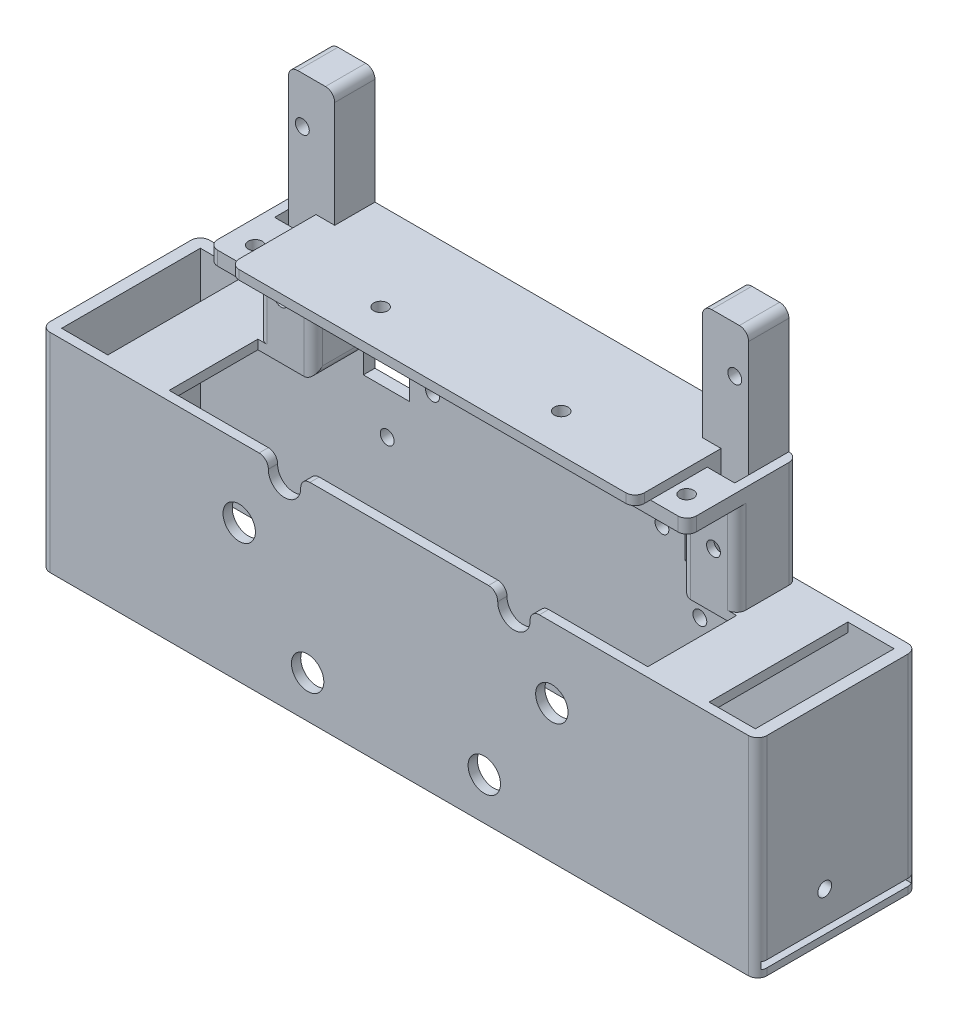
from build123d import *

# Parameters (mm, degrees)
SKETCH_1_W           = 12
SKETCH_1_H           = 3
EXTRUDE_1_DEPTH      = 19
EXTRUDE_START        = 5.8
EXTRUDE_2_DEPTH      = 13.2
SKETCH_1_14_W        = 4.05
SKETCH_1_14_H        = 2
EXTRUDE_3_DEPTH      = 22.3
SKETCH_1_15_W        = 39.75
SKETCH_1_15_H        = 2
EXTRUDE_4_DEPTH      = 16.5
SKETCH_1_16_W        = 12
SKETCH_1_16_H        = 65
EXTRUDE_5_DEPTH      = 3.7
SKETCH_1_20_W        = 39.75
SKETCH_1_20_H        = 26.5
SKETCH_1_20_H_2      = 18.5
SKETCH_1_20_W_2      = 15
SKETCH_1_20_H_3      = 16.5
SKETCH_1_20_W_3      = 24.75
EXTRUDE_6_DEPTH      = 2.5
EXTRUDE_START_2      = 3.7
SKETCH_1_23_W        = 10
SKETCH_1_23_H        = 26.5
SKETCH_1_23_H_2      = 18.5
SKETCH_1_23_H_3      = 3.5
SKETCH_1_23_W_2      = 2
SKETCH_1_23_H_4      = 16.5
EXTRUDE_8_DEPTH      = 4.6
EXTRUDE_START_3      = 27.5
SKETCH_1_25_W        = 39.75
SKETCH_1_25_H        = 26.5
SKETCH_1_25_H_2      = 18.5
SKETCH_1_25_W_2      = 10
EXTRUDE_9_DEPTH      = 2
SKETCH_3_W           = 25.25
SKETCH_3_H           = 45
EXTRUDE_11_DEPTH     = 2
SKETCH_3_4_W         = 2.5
SKETCH_3_4_H         = 45
EXTRUDE_12_DEPTH     = 29.5
EXTRUDE_START_4      = -2.5
SKETCH_5_W           = 8.3
SKETCH_5_H           = 45
EXTRUDE_13_DEPTH     = 23.25
CUT_EXTRUDE_1_REACH  = 151.919
SKETCH_6_W           = 5.95
SKETCH_6_H           = 3
SKETCH_7_W           = 13.25
SKETCH_7_H           = 19.2
EXTRUDE_14_DEPTH     = 2
SKETCH_1_29_W        = 39.75
SKETCH_1_29_H        = 25
SKETCH_1_29_H_2      = 18.5
SKETCH_1_29_H_3      = 26.5
SKETCH_1_29_W_2      = 24.75
SKETCH_1_29_H_4      = 16.5
SKETCH_1_29_W_3      = 15
SKETCH_1_29_H_5      = 2
EXTRUDE_15_DEPTH     = 5.8
CUT_EXTRUDE_START    = 19.2
CUT_EXTRUDE_10_DEPTH = 5.8
SKETCH_9_R           = 1.5
CUT_EXTRUDE_12_DEPTH = 148.650982049
EXTRUDE_START_5      = 5
SKETCH_21_R          = 1.5
EXTRUDE_16_DEPTH     = 5
CUT_EXTRUDE_START_2  = 25
CUT_EXTRUDE_14_DEPTH = 5
CUT_EXTRUDE_START_3  = -10.8
SKETCH_24_R          = 1.5
CUT_EXTRUDE_16_DEPTH = 10.8
CUT_EXTRUDE_15_REACH = 107.364
SKETCH_23_R          = 1.5
FILLET_1_R           = 2
CUT_EXTRUDE_17_REACH = 150.731
SKETCH_25_W          = 10
SKETCH_25_H          = 25.1
SKETCH_25_W_2        = 79.5
SKETCH_25_H_2        = 25
SKETCH_25_4_R        = 1.5
CUT_EXTRUDE_18_DEPTH = 149.730671013
CUT_EXTRUDE_19_REACH = 150.28
SKETCH_28_R          = 1.5
SKETCH_28_R_2        = 3.5
FILLET_2_R           = 2
SKETCH_25_5_R        = 1.5
CUT_EXTRUDE_20_DEPTH = 149.730671013
CUT_EXTRUDE_START_4  = -1.5
CUT_EXTRUDE_24_DEPTH = 1.5


with BuildPart() as part:
    # 草图1 → 凸台-拉伸1 (new body)
    with BuildSketch(Plane.XY):
        with Locations((97.5, 1.5)):
            Rectangle(SKETCH_1_W, SKETCH_1_H)
    extrude(amount=EXTRUDE_1_DEPTH)

    # 草图1<13> → 凸台-拉伸2 (add)
    with BuildSketch(Plane.XY.offset(EXTRUDE_START)):
        Polygon((91.5, 3), (51.75, 3), (51.75, 0), (66.75, 0), (91.5, 0), align=None)
    extrude(amount=EXTRUDE_2_DEPTH)

    # 草图1<14> → 凸台-拉伸3 (add)
    with BuildSketch(Plane.XY):
        with Locations((93.525, 4)):
            Rectangle(SKETCH_1_14_W, SKETCH_1_14_H)
    extrude(amount=EXTRUDE_3_DEPTH)

    # 草图1<15> → 凸台-拉伸4 (add)
    with BuildSketch(Plane.XY.offset(EXTRUDE_START)):
        with Locations((71.625, 4)):
            Rectangle(SKETCH_1_15_W, SKETCH_1_15_H)
    extrude(amount=EXTRUDE_4_DEPTH)

    # 草图1<16> → 凸台-拉伸5 (add)
    with BuildSketch(Plane.XY):
        Polygon((91.5, 30), (91.5, 5), (95.55, 5), (95.55, 3), (101.5, 3), (101.5, 30), align=None)
        with Locations((97.5, -32.5)):
            Rectangle(SKETCH_1_16_W, SKETCH_1_16_H)
    extrude(amount=EXTRUDE_5_DEPTH)

    # 草图1<20> → 凸台-拉伸6 (add)
    with BuildSketch(Plane.XY.offset(EXTRUDE_START)):
        with Locations((71.625, -33.25)):
            Rectangle(SKETCH_1_20_W, SKETCH_1_20_H)
        with Locations((71.625, -55.75)):
            Rectangle(SKETCH_1_20_W, SKETCH_1_20_H_2)
        with Locations((59.25, -8.25)):
            Rectangle(SKETCH_1_20_W_2, SKETCH_1_20_H_3)
        Polygon((66.75, -16.5), (51.75, -16.5), (51.75, -20), (91.5, -20), (91.5, -16.5), align=None)
        with Locations((79.125, -8.25)):
            Rectangle(SKETCH_1_20_W_3, SKETCH_1_20_H_3)
    extrude(amount=EXTRUDE_6_DEPTH)

    # 草图1<23> → 凸台-拉伸8 (add)
    with BuildSketch(Plane.XY.offset(EXTRUDE_START_2)):
        with Locations((96.5, -33.25)):
            Rectangle(SKETCH_1_23_W, SKETCH_1_23_H)
        with Locations((96.5, -55.75)):
            Rectangle(SKETCH_1_23_W, SKETCH_1_23_H_2)
        with Locations((96.5, -18.25)):
            Rectangle(SKETCH_1_23_W, SKETCH_1_23_H_3)
        with Locations((102.5, -18.25)):
            Rectangle(SKETCH_1_23_W_2, SKETCH_1_23_H_3)
        with Locations((102.5, -33.25)):
            Rectangle(SKETCH_1_23_W_2, SKETCH_1_23_H)
        with Locations((102.5, -55.75)):
            Rectangle(SKETCH_1_23_W_2, SKETCH_1_23_H_2)
        with Locations((96.5, -8.25)):
            Rectangle(SKETCH_1_23_W, SKETCH_1_23_H_4)
        with Locations((102.5, -8.25)):
            Rectangle(SKETCH_1_23_W_2, SKETCH_1_23_H_4)
    extrude(amount=EXTRUDE_8_DEPTH)



with BuildPart() as body_2:
    # 草图1<25> → 凸台-拉伸9 (new body)
    with BuildSketch(Plane.XY.offset(EXTRUDE_START_3)):
        with Locations((71.625, -33.25)):
            Rectangle(SKETCH_1_25_W, SKETCH_1_25_H)
        with Locations((71.625, -55.75)):
            Rectangle(SKETCH_1_25_W, SKETCH_1_25_H_2)
        with Locations((96.5, -55.75)):
            Rectangle(SKETCH_1_25_W_2, SKETCH_1_25_H_2)
        with Locations((96.5, -33.25)):
            Rectangle(SKETCH_1_25_W_2, SKETCH_1_25_H)
    extrude(amount=EXTRUDE_9_DEPTH)

    # 草图3 → 凸台-拉伸11 (add)
    with BuildSketch(Plane.XY.offset(29.5)):
        with Locations((114.125, -42.5)):
            Rectangle(SKETCH_3_W, SKETCH_3_H)
    extrude(amount=-EXTRUDE_11_DEPTH)

    # 草图3<4> → 凸台-拉伸12 (add)
    with BuildSketch(Plane.XY.offset(29.5)):
        with Locations((128, -42.5)):
            Rectangle(SKETCH_3_4_W, SKETCH_3_4_H)
    extrude(amount=-EXTRUDE_12_DEPTH)


with BuildPart() as part_1:
    add(part.part)

    add(body_2.part)  # 凸台-拉伸13 merges body 2
    # 草图5 → 凸台-拉伸13 (add)
    with BuildSketch(Plane(origin=(129.25, 0, 0), x_dir=(0, 0, -1), z_dir=(1, 0, 0)).offset(EXTRUDE_START_4)):
        with Locations((-4.15, -42.5)):
            Rectangle(SKETCH_5_W, SKETCH_5_H)
    extrude(amount=-EXTRUDE_13_DEPTH)

    # 草图6 → 切除-拉伸1 (cut, up to next)
    with BuildSketch(Plane(origin=(0, 5, 0), x_dir=(1, 0, 0), z_dir=(0, 1, 0)), mode=Mode.PRIVATE) as cut_extrude_1_sk1:
        with BuildLine():
            ThreePointArc((69.77, -14), (71.27, -15.5), (72.77, -14))
            Line((72.77, -14), (69.77, -14))
        make_face()
    cut_extrude_1_tool1 = extrude(cut_extrude_1_sk1.sketch, amount=-CUT_EXTRUDE_1_REACH, mode=Mode.PRIVATE) & part_1.part
    # 草图6 → 切除-拉伸1 (cut, up to next)
    with BuildSketch(Plane(origin=(0, 5, 0), x_dir=(1, 0, 0), z_dir=(0, 1, 0)), mode=Mode.PRIVATE) as cut_extrude_1_sk2:
        with BuildLine():
            Line((69.77, -14), (72.77, -14))
            ThreePointArc((72.77, -14), (71.27, -12.5), (69.77, -14))
        make_face()
    cut_extrude_1_tool2 = extrude(cut_extrude_1_sk2.sketch, amount=-CUT_EXTRUDE_1_REACH, mode=Mode.PRIVATE) & part_1.part
    # 草图6 → 切除-拉伸1 (cut, up to next)
    with BuildSketch(Plane(origin=(0, 5, 0), x_dir=(1, 0, 0), z_dir=(0, 1, 0)), mode=Mode.PRIVATE) as cut_extrude_1_sk3:
        with BuildLine():
            ThreePointArc((69.77, -14), (71.27, -15.5), (72.77, -14))
            Line((72.77, -14), (69.77, -14))
        make_face()
    cut_extrude_1_tool3 = extrude(cut_extrude_1_sk3.sketch, amount=-CUT_EXTRUDE_1_REACH, mode=Mode.PRIVATE) & part_1.part
    # 草图6 → 切除-拉伸1 (cut, up to next)
    with BuildSketch(Plane(origin=(0, 5, 0), x_dir=(1, 0, 0), z_dir=(0, 1, 0)), mode=Mode.PRIVATE) as cut_extrude_1_sk4:
        with BuildLine():
            Line((69.77, -14), (72.77, -14))
            ThreePointArc((72.77, -14), (71.27, -12.5), (69.77, -14))
        make_face()
    cut_extrude_1_tool4 = extrude(cut_extrude_1_sk4.sketch, amount=-CUT_EXTRUDE_1_REACH, mode=Mode.PRIVATE) & part_1.part
    # 草图6 → 切除-拉伸1 (cut, up to next)
    with BuildSketch(Plane(origin=(0, 5, 0), x_dir=(1, 0, 0), z_dir=(0, 1, 0)), mode=Mode.PRIVATE) as cut_extrude_1_sk5:
        with BuildLine():
            ThreePointArc((96.89, -14), (98.39, -15.5), (99.89, -14))
            Line((99.89, -14), (96.89, -14))
        make_face()
    cut_extrude_1_tool5 = extrude(cut_extrude_1_sk5.sketch, amount=-CUT_EXTRUDE_1_REACH, mode=Mode.PRIVATE) & part_1.part
    # 草图6 → 切除-拉伸1 (cut, up to next)
    with BuildSketch(Plane(origin=(0, 5, 0), x_dir=(1, 0, 0), z_dir=(0, 1, 0)), mode=Mode.PRIVATE) as cut_extrude_1_sk6:
        with BuildLine():
            Line((96.89, -14), (99.89, -14))
            ThreePointArc((99.89, -14), (98.39, -12.5), (96.89, -14))
        make_face()
    cut_extrude_1_tool6 = extrude(cut_extrude_1_sk6.sketch, amount=-CUT_EXTRUDE_1_REACH, mode=Mode.PRIVATE) & part_1.part
    # 草图6 → 切除-拉伸1 (cut, up to next)
    with BuildSketch(Plane(origin=(0, 5, 0), x_dir=(1, 0, 0), z_dir=(0, 1, 0)), mode=Mode.PRIVATE) as cut_extrude_1_sk7:
        with BuildLine():
            ThreePointArc((96.89, -14), (98.39, -15.5), (99.89, -14))
            Line((99.89, -14), (96.89, -14))
        make_face()
    cut_extrude_1_tool7 = extrude(cut_extrude_1_sk7.sketch, amount=-CUT_EXTRUDE_1_REACH, mode=Mode.PRIVATE) & part_1.part
    # 草图6 → 切除-拉伸1 (cut, up to next)
    with BuildSketch(Plane(origin=(0, 5, 0), x_dir=(1, 0, 0), z_dir=(0, 1, 0)), mode=Mode.PRIVATE) as cut_extrude_1_sk8:
        with BuildLine():
            Line((96.89, -14), (99.89, -14))
            ThreePointArc((99.89, -14), (98.39, -12.5), (96.89, -14))
        make_face()
    cut_extrude_1_tool8 = extrude(cut_extrude_1_sk8.sketch, amount=-CUT_EXTRUDE_1_REACH, mode=Mode.PRIVATE) & part_1.part
    # 草图6 → 切除-拉伸1 (cut, up to next)
    with BuildSketch(Plane(origin=(0, 5, 0), x_dir=(1, 0, 0), z_dir=(0, 1, 0)), mode=Mode.PRIVATE) as cut_extrude_1_sk9:
        with Locations((98.525, -5.2)):
            Rectangle(SKETCH_6_W, SKETCH_6_H)
    cut_extrude_1_tool9 = extrude(cut_extrude_1_sk9.sketch, amount=-CUT_EXTRUDE_1_REACH, mode=Mode.PRIVATE) & part_1.part
    add(cut_extrude_1_tool1.solids().sort_by_distance((71.27, 5, 14.63662))[0], mode=Mode.SUBTRACT)
    add(cut_extrude_1_tool2.solids().sort_by_distance((71.27, 5, 13.36338))[0], mode=Mode.SUBTRACT)
    add(cut_extrude_1_tool3.solids().sort_by_distance((71.27, 5, 14.63662))[0], mode=Mode.SUBTRACT)
    add(cut_extrude_1_tool4.solids().sort_by_distance((71.27, 5, 13.36338))[0], mode=Mode.SUBTRACT)
    add(cut_extrude_1_tool5.solids().sort_by_distance((98.39, 5, 14.63662))[0], mode=Mode.SUBTRACT)
    add(cut_extrude_1_tool6.solids().sort_by_distance((98.39, 5, 13.36338))[0], mode=Mode.SUBTRACT)
    add(cut_extrude_1_tool7.solids().sort_by_distance((98.39, 5, 14.63662))[0], mode=Mode.SUBTRACT)
    add(cut_extrude_1_tool8.solids().sort_by_distance((98.39, 5, 13.36338))[0], mode=Mode.SUBTRACT)
    add(cut_extrude_1_tool9.solids().sort_by_distance((98.525, 5, 5.2))[0], mode=Mode.SUBTRACT)

    # 草图7 → 凸台-拉伸14 (add)
    with BuildSketch(Plane(origin=(0, -20, 0), x_dir=(1, 0, 0), z_dir=(0, 1, 0))):
        with Locations((110.125, -17.9)):
            Rectangle(SKETCH_7_W, SKETCH_7_H)
    extrude(amount=-EXTRUDE_14_DEPTH)

    # 草图1<29> → 凸台-拉伸15 (add)
    with BuildSketch(Plane.XY):
        with Locations((71.625, 17.5)):
            Rectangle(SKETCH_1_29_W, SKETCH_1_29_H)
        with Locations((71.625, -55.75)):
            Rectangle(SKETCH_1_29_W, SKETCH_1_29_H_2)
        with Locations((71.625, -33.25)):
            Rectangle(SKETCH_1_29_W, SKETCH_1_29_H_3)
        with Locations((79.125, -8.25)):
            Rectangle(SKETCH_1_29_W_2, SKETCH_1_29_H_4)
        with Locations((59.25, -8.25)):
            Rectangle(SKETCH_1_29_W_3, SKETCH_1_29_H_4)
        Polygon((91.5, 3), (51.75, 3), (51.75, 0), (66.75, 0), (91.5, 0), align=None)
        with Locations((71.625, 4)):
            Rectangle(SKETCH_1_29_W, SKETCH_1_29_H_5)
        Polygon((66.75, -16.5), (51.75, -16.5), (51.75, -20), (91.5, -20), (91.5, -16.5), align=None)
    extrude(amount=EXTRUDE_15_DEPTH)

    # 草图17 → 切除-拉伸10 (cut)
    with BuildSketch(Plane(origin=(0, 0, 27.5), x_dir=(-1, 0, 0), z_dir=(0, 0, -1)).offset(CUT_EXTRUDE_START)):
        Polygon((-51.75, -22), (-103.5, -22), (-116.75, -22), (-116.75, -20), (-126.75, -20), (-126.75, -65), (-51.75, -65), align=None)
    extrude(amount=CUT_EXTRUDE_10_DEPTH, mode=Mode.SUBTRACT)

    # 草图9 → 切除-拉伸12 (cut, through all)
    with BuildSketch(Plane(origin=(0, 0, 0), x_dir=(-1, 0, 0), z_dir=(0, 0, -1))):
        with Locations((-76.55, -5)):
            Circle(SKETCH_9_R)
        with Locations((-76.55, -22.1)):
            Circle(SKETCH_9_R)
    extrude(amount=-CUT_EXTRUDE_12_DEPTH, mode=Mode.SUBTRACT)

    # 草图21 → 凸台-拉伸16 (add)
    with BuildSketch(Plane(origin=(0, 0, 0), x_dir=(-1, 0, 0), z_dir=(0, 0, -1)).offset(EXTRUDE_START_5)):
        Polygon((-101.5, 30), (-101.5, 3), (-103.5, 3), (-103.5, -20), (-129.25, -20), (-129.25, -65), (-51.75, -65), (-51.75, 30), align=None)
        with Locations((-76.55, -22.1)):
            Circle(SKETCH_21_R, mode=Mode.SUBTRACT)
        with Locations((-76.55, -5)):
            Circle(SKETCH_21_R, mode=Mode.SUBTRACT)
    extrude(amount=-EXTRUDE_16_DEPTH)

    # 草图17<10> → 切除-拉伸14 (cut)
    with BuildSketch(Plane(origin=(0, 0, 27.5), x_dir=(-1, 0, 0), z_dir=(0, 0, -1)).offset(CUT_EXTRUDE_START_2)):
        Polygon((-51.75, -22), (-103.5, -22), (-116.75, -22), (-116.75, -20), (-126.75, -20), (-126.75, -65), (-51.75, -65), align=None)
    extrude(amount=CUT_EXTRUDE_14_DEPTH, mode=Mode.SUBTRACT)

    # 草图24 → 切除-拉伸16 (cut)
    with BuildSketch(Plane.XY.offset(8.3).offset(CUT_EXTRUDE_START_3)):
        with BuildLine():
            ThreePointArc((75.053337045, -22), (76.55, -20.6), (78.046662955, -22))
            Line((78.046662955, -22), (91.5, -22))
            Line((91.5, -22), (91.5, 0))
            Line((91.5, 0), (51.75, 0))
            Line((51.75, 0), (51.75, -22))
            Line((51.75, -22), (75.053337045, -22))
        make_face()
        with Locations((76.55, -5)):
            Circle(SKETCH_24_R, mode=Mode.SUBTRACT)
    extrude(amount=CUT_EXTRUDE_16_DEPTH, mode=Mode.SUBTRACT)

    # 草图23 → 切除-拉伸15 (cut, up to next)
    with BuildSketch(Plane(origin=(129.25, 0, 0), x_dir=(0, 0, -1), z_dir=(1, 0, 0)), mode=Mode.PRIVATE) as cut_extrude_15_sk1:
        with Locations(Location((-15, -55, 0), (0, 0, 90))):
            Circle(SKETCH_23_R)
    cut_extrude_15_tool1 = extrude(cut_extrude_15_sk1.sketch, amount=-CUT_EXTRUDE_15_REACH, mode=Mode.PRIVATE) & part_1.part
    add(cut_extrude_15_tool1.solids().sort_by_distance((129.25, -55, 15))[0], mode=Mode.SUBTRACT)

    # 圆角1
    fillet_1_edges = [part_1.edges().sort_by_distance(p)[0] for p in [
        (71.625, 30, 5.8),
        (129.25, -42.5, 29.5),
        (129.25, -42.5, -5),
        (103.5, -8.5, -5),
        (95.55, 4, 22.3),
        (103.5, 1.5, 19),
        (101.5, 30, -0.65),
        (103.5, -10, 8.3),
        (91.5, -11, 8.3),
        (91.5, -22, 2.9),
    ]]
    fillet(fillet_1_edges, radius=FILLET_1_R)

    # 镜向2: part across plane


with BuildPart() as part_2:
    add(part_1.part)
    add(part_1.part.mirror(Plane.ZY.offset(-51.75)))

    # 草图25 → 切除-拉伸17 (cut, up to next)
    with BuildSketch(Plane(origin=(0, 0, -5), x_dir=(-1, 0, 0), z_dir=(0, 0, -1)), mode=Mode.PRIVATE) as cut_extrude_17_sk1:
        with Locations((-86.5, -13.55)):
            Rectangle(SKETCH_25_W, SKETCH_25_H)
    cut_extrude_17_tool1 = extrude(cut_extrude_17_sk1.sketch, amount=-CUT_EXTRUDE_17_REACH, mode=Mode.PRIVATE) & part_2.part
    # 草图25 → 切除-拉伸17 (cut, up to next)
    with BuildSketch(Plane(origin=(0, 0, -5), x_dir=(-1, 0, 0), z_dir=(0, 0, -1)), mode=Mode.PRIVATE) as cut_extrude_17_sk2:
        with Locations((-17, -13.55)):
            Rectangle(SKETCH_25_W, SKETCH_25_H)
    cut_extrude_17_tool2 = extrude(cut_extrude_17_sk2.sketch, amount=-CUT_EXTRUDE_17_REACH, mode=Mode.PRIVATE) & part_2.part
    # 草图25 → 切除-拉伸17 (cut, up to next)
    with BuildSketch(Plane(origin=(0, 0, -5), x_dir=(-1, 0, 0), z_dir=(0, 0, -1)), mode=Mode.PRIVATE) as cut_extrude_17_sk3:
        with Locations((-51.75, 17.5)):
            Rectangle(SKETCH_25_W_2, SKETCH_25_H_2)
    cut_extrude_17_tool3 = extrude(cut_extrude_17_sk3.sketch, amount=-CUT_EXTRUDE_17_REACH, mode=Mode.PRIVATE) & part_2.part
    add(cut_extrude_17_tool1.solids().sort_by_distance((86.5, -13.55, -5))[0], mode=Mode.SUBTRACT)
    add(cut_extrude_17_tool2.solids().sort_by_distance((17, -13.55, -5))[0], mode=Mode.SUBTRACT)
    add(cut_extrude_17_tool3.solids().sort_by_distance((51.75, 17.5, -5))[0], mode=Mode.SUBTRACT)

    # 草图25<4> → 切除-拉伸18 (cut, through all)
    with BuildSketch(Plane(origin=(0, 0, -5), x_dir=(-1, 0, 0), z_dir=(0, 0, -1))):
        with Locations((-17.15, -35.2)):
            Circle(SKETCH_25_4_R)
        with Locations((-31.95, -55.9)):
            Circle(SKETCH_25_4_R)
        with Locations((-84.75, -35.2)):
            Circle(SKETCH_25_4_R)
        with Locations((-70.15, -55.9)):
            Circle(SKETCH_25_4_R)
    extrude(amount=-CUT_EXTRUDE_18_DEPTH, mode=Mode.SUBTRACT)

    # 草图28 → 切除-拉伸19 (cut, up to next)
    with BuildSketch(Plane(origin=(0, 0, 27.5), x_dir=(-1, 0, 0), z_dir=(0, 0, -1)), mode=Mode.PRIVATE) as cut_extrude_19_sk1:
        with BuildLine():
            Line((-73.75, -20), (-79.35, -20))
            ThreePointArc((-79.35, -20), (-77.656797181, -25.420391543), (-73.05, -22.1))
            ThreePointArc((-73.05, -22.1), (-73.229608457, -20.993202819), (-73.75, -20))
        make_face()
        with Locations((-76.55, -22.1)):
            Circle(SKETCH_28_R, mode=Mode.SUBTRACT)
    cut_extrude_19_tool1 = extrude(cut_extrude_19_sk1.sketch, amount=-CUT_EXTRUDE_19_REACH, mode=Mode.PRIVATE) & part_2.part
    # 草图28 → 切除-拉伸19 (cut, up to next)
    with BuildSketch(Plane(origin=(0, 0, 27.5), x_dir=(-1, 0, 0), z_dir=(0, 0, -1)), mode=Mode.PRIVATE) as cut_extrude_19_sk2:
        with Locations((-84.75, -35.2)):
            Circle(SKETCH_28_R_2)
        with Locations((-84.75, -35.2)):
            Circle(SKETCH_28_R, mode=Mode.SUBTRACT)
    cut_extrude_19_tool2 = extrude(cut_extrude_19_sk2.sketch, amount=-CUT_EXTRUDE_19_REACH, mode=Mode.PRIVATE) & part_2.part
    # 草图28 → 切除-拉伸19 (cut, up to next)
    with BuildSketch(Plane(origin=(0, 0, 27.5), x_dir=(-1, 0, 0), z_dir=(0, 0, -1)), mode=Mode.PRIVATE) as cut_extrude_19_sk3:
        with Locations((-70.15, -55.9)):
            Circle(SKETCH_28_R_2)
        with Locations((-70.15, -55.9)):
            Circle(SKETCH_28_R, mode=Mode.SUBTRACT)
    cut_extrude_19_tool3 = extrude(cut_extrude_19_sk3.sketch, amount=-CUT_EXTRUDE_19_REACH, mode=Mode.PRIVATE) & part_2.part
    # 草图28 → 切除-拉伸19 (cut, up to next)
    with BuildSketch(Plane(origin=(0, 0, 27.5), x_dir=(-1, 0, 0), z_dir=(0, 0, -1)), mode=Mode.PRIVATE) as cut_extrude_19_sk4:
        with Locations((-31.95, -55.9)):
            Circle(SKETCH_28_R_2)
        with Locations((-31.95, -55.9)):
            Circle(SKETCH_28_R, mode=Mode.SUBTRACT)
    cut_extrude_19_tool4 = extrude(cut_extrude_19_sk4.sketch, amount=-CUT_EXTRUDE_19_REACH, mode=Mode.PRIVATE) & part_2.part
    # 草图28 → 切除-拉伸19 (cut, up to next)
    with BuildSketch(Plane(origin=(0, 0, 27.5), x_dir=(-1, 0, 0), z_dir=(0, 0, -1)), mode=Mode.PRIVATE) as cut_extrude_19_sk5:
        with Locations((-17.15, -35.2)):
            Circle(SKETCH_28_R_2)
        with Locations((-17.15, -35.2)):
            Circle(SKETCH_28_R, mode=Mode.SUBTRACT)
    cut_extrude_19_tool5 = extrude(cut_extrude_19_sk5.sketch, amount=-CUT_EXTRUDE_19_REACH, mode=Mode.PRIVATE) & part_2.part
    # 草图28 → 切除-拉伸19 (cut, up to next)
    with BuildSketch(Plane(origin=(0, 0, 27.5), x_dir=(-1, 0, 0), z_dir=(0, 0, -1)), mode=Mode.PRIVATE) as cut_extrude_19_sk6:
        with BuildLine():
            Line((-24.15, -20), (-29.75, -20))
            ThreePointArc((-29.75, -20), (-28.056797181, -25.420391543), (-23.45, -22.1))
            ThreePointArc((-23.45, -22.1), (-23.629608457, -20.993202819), (-24.15, -20))
        make_face()
        with Locations(Location((-26.95, -22.1, 0), (0, 0, 180))):
            Circle(SKETCH_28_R, mode=Mode.SUBTRACT)
    cut_extrude_19_tool6 = extrude(cut_extrude_19_sk6.sketch, amount=-CUT_EXTRUDE_19_REACH, mode=Mode.PRIVATE) & part_2.part
    add(cut_extrude_19_tool1.solids().sort_by_distance((76.55, -20.089644, 27.5))[0], mode=Mode.SUBTRACT)
    add(cut_extrude_19_tool2.solids().sort_by_distance((88.151005, -35.2, 27.5))[0], mode=Mode.SUBTRACT)
    add(cut_extrude_19_tool3.solids().sort_by_distance((73.551005, -55.9, 27.5))[0], mode=Mode.SUBTRACT)
    add(cut_extrude_19_tool4.solids().sort_by_distance((35.351005, -55.9, 27.5))[0], mode=Mode.SUBTRACT)
    add(cut_extrude_19_tool5.solids().sort_by_distance((20.551005, -35.2, 27.5))[0], mode=Mode.SUBTRACT)
    add(cut_extrude_19_tool6.solids().sort_by_distance((26.95, -20.089644, 27.5))[0], mode=Mode.SUBTRACT)

    # 圆角2
    fillet_2_edges = [part_2.edges().sort_by_distance(p)[0] for p in [
        (91.5, 30, -0.65),
        (12, 30, -0.65),
        (29.75, -20, 28.5),
        (24.15, -20, 28.5),
        (79.35, -20, 28.5),
        (73.75, -20, 28.5),
    ]]
    fillet(fillet_2_edges, radius=FILLET_2_R)

    # 草图25<5> → 切除-拉伸20 (cut, through all)
    with BuildSketch(Plane(origin=(0, 0, -5), x_dir=(-1, 0, 0), z_dir=(0, 0, -1))):
        with Locations((-98.5, 20)):
            Circle(SKETCH_25_5_R)
        with Locations(Location((-98.5, -10, 0), (0, 0, 180))):
            Circle(SKETCH_25_5_R)
        with Locations((-5, 20)):
            Circle(SKETCH_25_5_R)
        with Locations(Location((-5, -10, 0), (0, 0, 180))):
            Circle(SKETCH_25_5_R)
    extrude(amount=-CUT_EXTRUDE_20_DEPTH, mode=Mode.SUBTRACT)

    # 草图29 → 切除-拉伸24 (cut)
    with BuildSketch(Plane.XZ.offset(65).offset(CUT_EXTRUDE_START_4)):
        with BuildLine():
            Line((-23.25, -4), (128.982050808, -4))
            ThreePointArc((128.982050808, -4), (129.181851653, -3.51763809), (129.25, -3))
            Line((129.25, -3), (129.25, 27.5))
            ThreePointArc((129.25, 27.5), (129.181851653, 28.01763809), (128.982050808, 28.5))
            Line((128.982050808, 28.5), (-23.25, 28.5))
            Line((-23.25, 28.5), (-23.25, 27.5))
            Line((-23.25, 27.5), (126.75, 27.5))
            Line((126.75, 27.5), (126.75, -2.5))
            Line((126.75, -2.5), (-23.25, -2.5))
            Line((-23.25, -2.5), (-23.25, -4))
        make_face()
    extrude(amount=-CUT_EXTRUDE_24_DEPTH, mode=Mode.SUBTRACT)


solid = part_2.part
